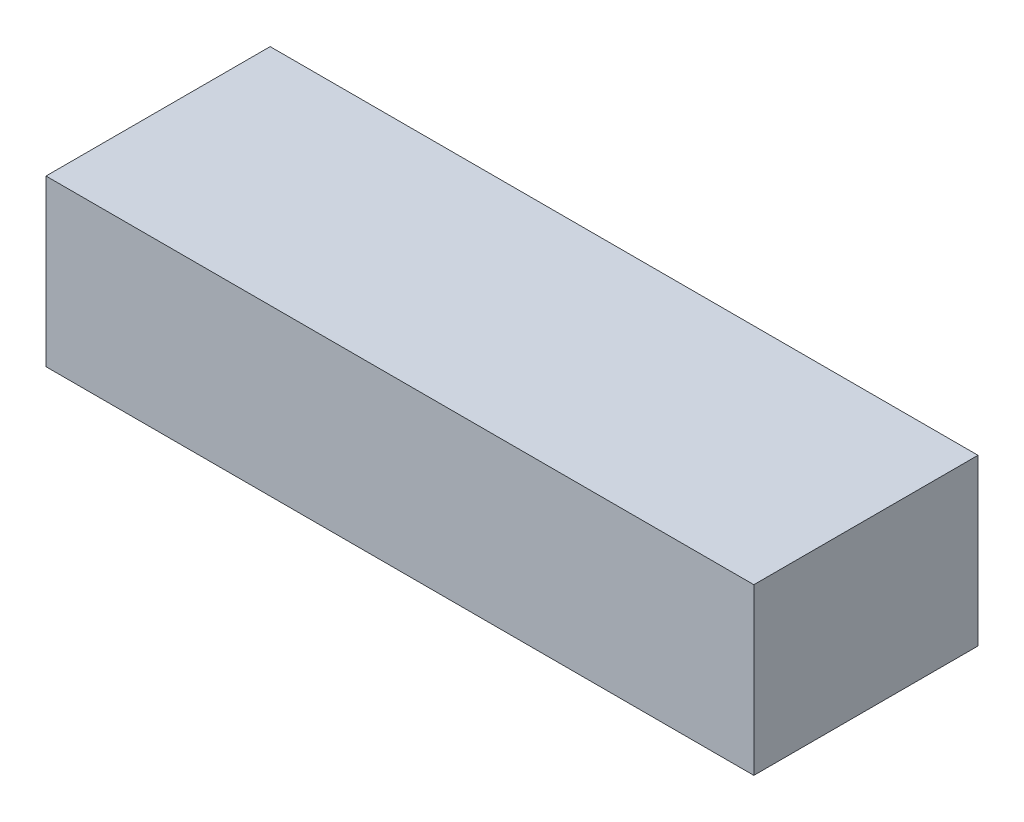
from build123d import *

# Parameters (mm, degrees)
SKETCH1_W           = 60
SKETCH1_H           = 19
BOSS_EXTRUDE1_DEPTH = 14


with BuildPart() as part:
    # Sketch1 → Boss-Extrude1 (new body)
    with BuildSketch(Plane(origin=(0, 0, 0), x_dir=(1, 0, 0), z_dir=(0, 1, 0))):
        with Locations((30, 9.5)):
            Rectangle(SKETCH1_W, SKETCH1_H)
    extrude(amount=BOSS_EXTRUDE1_DEPTH)


solid = part.part
